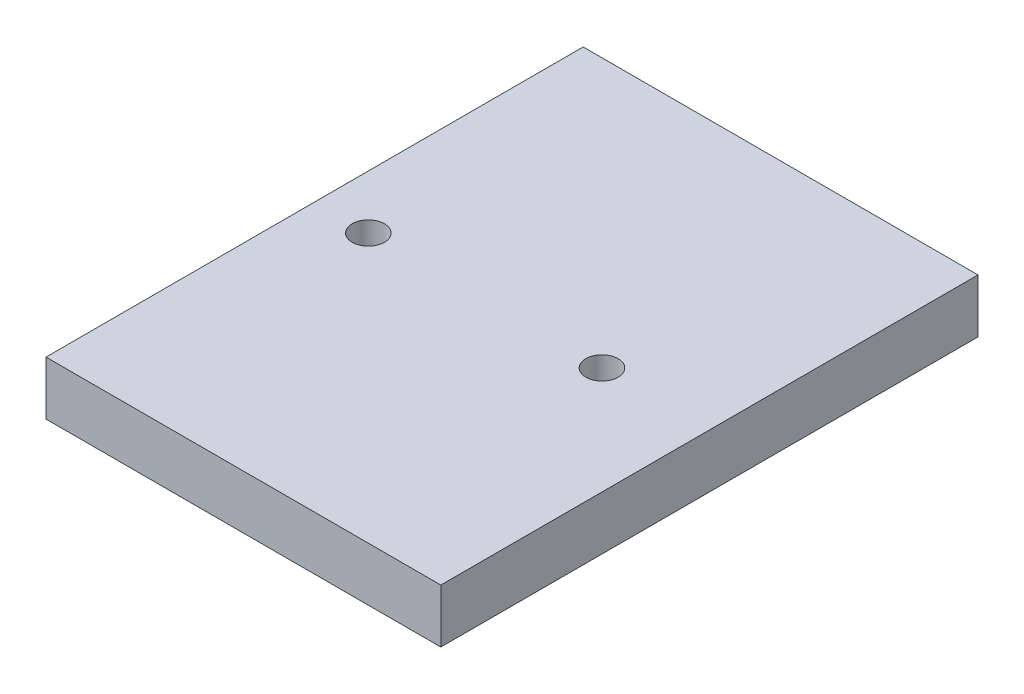
from build123d import *

# Parameters (mm, degrees)
SKETCH_4_W          = 36.75
SKETCH_4_H          = 10
SKETCH_4_R          = 1.5
EXTRUDE_1_DEPTH     = 5
SKETCH_5_W          = 36.75
SKETCH_5_H          = 5
EXTRUDE_2_DEPTH     = 20
EXTRUDE_START       = -10
SKETCH_5_2_W        = 36.75
SKETCH_5_2_H        = 5
EXTRUDE_3_DEPTH     = 20
SKETCH_6_R          = 1
CUT_EXTRUDE_1_DEPTH = 4
SKETCH_4_5_R        = 2.25
CUT_EXTRUDE_2_DEPTH = 2


with BuildPart() as part:
    # 草图4 → 凸台-拉伸1 (new body)
    with BuildSketch(Plane(origin=(0, 0, 0), x_dir=(1, 0, 0), z_dir=(0, 1, 0))):
        with Locations((-18.375, -5)):
            Rectangle(SKETCH_4_W, SKETCH_4_H)
        with Locations(Location((-31.75, -5, 0), (0, 0, 270))):
            Circle(SKETCH_4_R, mode=Mode.SUBTRACT)
        with Locations(Location((-10, -5, 0), (0, 0, 270))):
            Circle(SKETCH_4_R, mode=Mode.SUBTRACT)
    extrude(amount=EXTRUDE_1_DEPTH)

    # 草图5 → 凸台-拉伸2 (add)
    with BuildSketch(Plane.XY.offset(10)):
        with Locations((-18.375, 2.5)):
            Rectangle(SKETCH_5_W, SKETCH_5_H)
    extrude(amount=EXTRUDE_2_DEPTH)

    # 草图5<2> → 凸台-拉伸3 (add)
    with BuildSketch(Plane.XY.offset(10).offset(EXTRUDE_START)):
        with Locations((-18.375, 2.5)):
            Rectangle(SKETCH_5_2_W, SKETCH_5_2_H)
    extrude(amount=-EXTRUDE_3_DEPTH)

    # 草图6 → 切除-拉伸1 (cut)
    with BuildSketch(Plane.ZY.offset(36.75)):
        with Locations((-10, 2.5)):
            Circle(SKETCH_6_R)
        with Locations((20, 2.5)):
            Circle(SKETCH_6_R)
    extrude(amount=-CUT_EXTRUDE_1_DEPTH, mode=Mode.SUBTRACT)

    # 草图4<5> → 切除-拉伸2 (cut)
    with BuildSketch(Plane(origin=(0, 0, 0), x_dir=(1, 0, 0), z_dir=(0, 1, 0))):
        with Locations(Location((-31.75, -5, 0), (0, 0, 270))):
            Circle(SKETCH_4_5_R)
        with Locations(Location((-10, -5, 0), (0, 0, 270))):
            Circle(SKETCH_4_5_R)
    extrude(amount=CUT_EXTRUDE_2_DEPTH, mode=Mode.SUBTRACT)


solid = part.part
